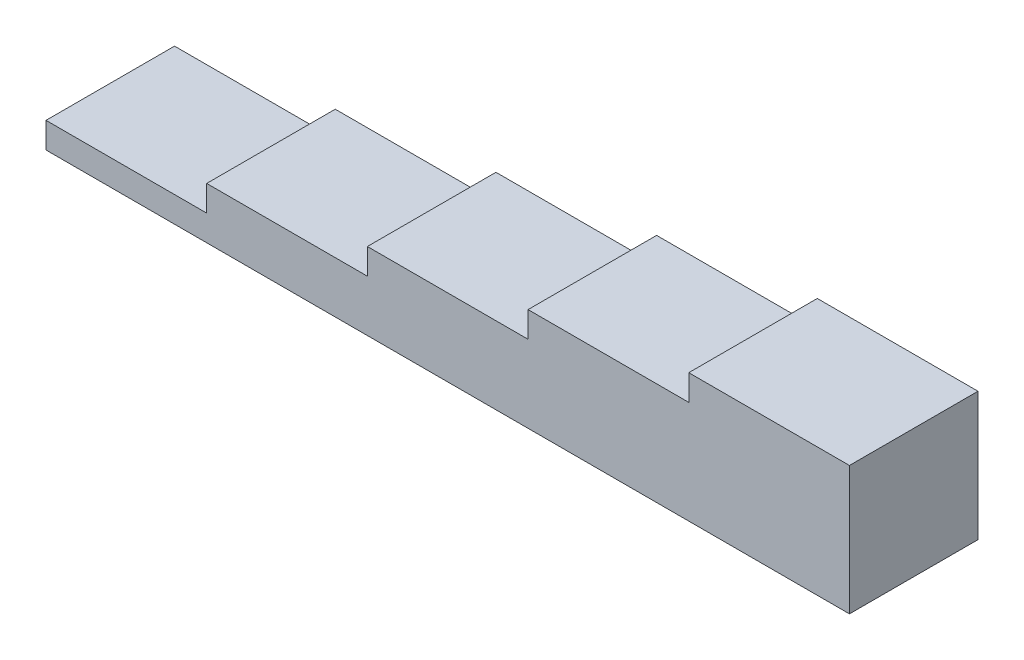
from build123d import *

# Parameters (mm, degrees)
EXTRUDE_1_DEPTH = 200


with BuildPart() as part:
    # 草图1 → 凸台-拉伸1 (new body)
    with BuildSketch(Plane.XY):
        Polygon((0, 0), (0, 40), (250, 40), (250, 80), (500, 80), (500, 120), (750, 120), (750, 160), (1000, 160), (1000, 200), (1250, 200), (1250, 0), align=None)
    extrude(amount=EXTRUDE_1_DEPTH)


solid = part.part
